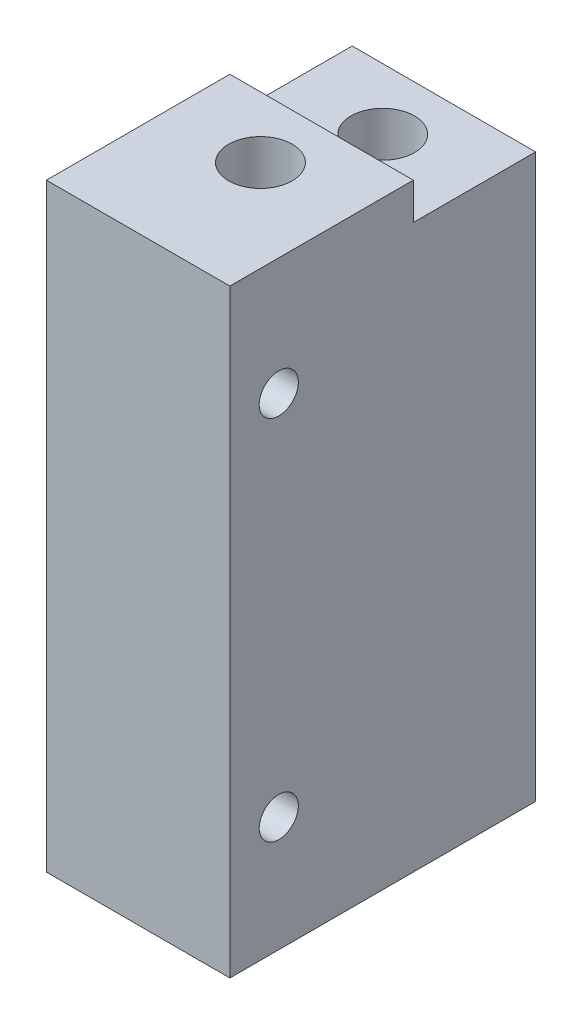
from build123d import *

# Parameters (mm, degrees)
SKETCH1_W           = 15
SKETCH1_H           = 49
SKETCH1_R           = 1.6
BOSS_EXTRUDE1_DEPTH = 15
SKETCH2_R           = 2.6
CUT_EXTRUDE1_DEPTH  = 54.394756297
SKETCH5_W           = 15
SKETCH5_H           = 46
BOSS_EXTRUDE3_DEPTH = 10
SKETCH6_R           = 2.6
CUT_EXTRUDE2_DEPTH  = 51.655700568
SKETCH7_W           = 15
SKETCH7_H           = 25
CUT_EXTRUDE3_DEPTH  = 49


with BuildPart() as part:
    # Sketch1 → Boss-Extrude1 (new body)
    with BuildSketch(Plane(origin=(0, 0, 0), x_dir=(0, 0, -1), z_dir=(1, 0, 0))):
        with Locations((-7.5, 24.5)):
            Rectangle(SKETCH1_W, SKETCH1_H)
        with Locations((-11, 39.6)):
            Circle(SKETCH1_R, mode=Mode.SUBTRACT)
        with Locations((-11, 9.6)):
            Circle(SKETCH1_R, mode=Mode.SUBTRACT)
    extrude(amount=BOSS_EXTRUDE1_DEPTH)

    # Sketch2 → Cut-Extrude1 (cut, through all)
    with BuildSketch(Plane.XZ):
        with Locations(Location((7.5, 5, 0), (0, 0, 270))):
            Circle(SKETCH2_R)
    extrude(amount=-CUT_EXTRUDE1_DEPTH, mode=Mode.SUBTRACT)

    # Sketch5 → Boss-Extrude3 (add)
    with BuildSketch(Plane(origin=(0, 0, 0), x_dir=(-1, 0, 0), z_dir=(0, 0, -1))):
        with Locations((-7.5, 26)):
            Rectangle(SKETCH5_W, SKETCH5_H)
    extrude(amount=BOSS_EXTRUDE3_DEPTH)

    # Sketch6 → Cut-Extrude2 (cut, through all)
    with BuildSketch(Plane.XZ.offset(-3)):
        with Locations(Location((7.5, -5, 0), (0, 0, 270))):
            Circle(SKETCH6_R)
    extrude(amount=-CUT_EXTRUDE2_DEPTH, mode=Mode.SUBTRACT)

    # Mirror1: part across plane


with BuildPart() as part_1:
    add(part.part)
    add(part.part.mirror(Plane(origin=(15, 49, 0), x_dir=(0, 0, 1), z_dir=(0, -1, 0))))

    # Sketch7 → Cut-Extrude3 (cut)
    with BuildSketch(Plane.XZ):
        with Locations((7.5, 2.5)):
            Rectangle(SKETCH7_W, SKETCH7_H)
    extrude(amount=-CUT_EXTRUDE3_DEPTH, mode=Mode.SUBTRACT)


solid = part_1.part
